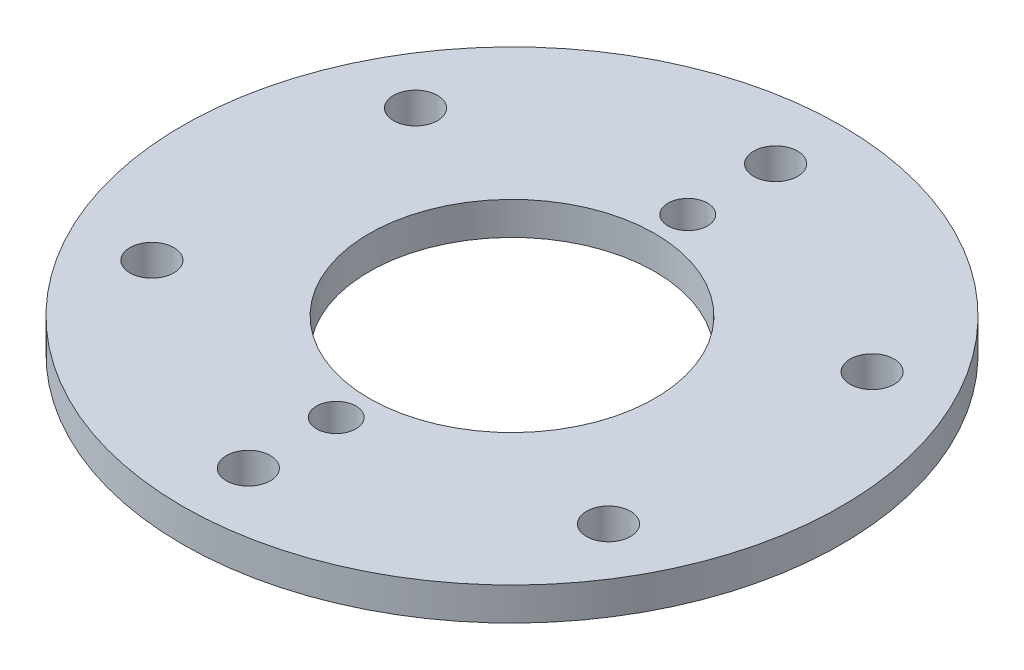
from build123d import *

# Parameters (mm, degrees)
SKETCH1_R             = 150
SKETCH1_R_2           = 65
BOSS_EXTRUDE1_DEPTH   = 15
F_1_0MM_DOWEL_HOLE1_D = 20
CIRPATTERN1_COUNT     = 6
F_1_0MM_DOWEL_HOLE2_D = 18


with BuildPart() as part:
    # Sketch1 → Boss-Extrude1 (new body)
    with BuildSketch(Plane(origin=(0, 0, 0), x_dir=(1, 0, 0), z_dir=(0, 1, 0))):
        with Locations(Location((0, 0, 0), (0, 0, 270))):
            Circle(SKETCH1_R)
        with Locations(Location((0, 0, 0), (0, 0, 270))):
            Circle(SKETCH1_R_2, mode=Mode.SUBTRACT)
    extrude(amount=BOSS_EXTRUDE1_DEPTH)

    # Ø1.0mm Dowel Hole1 (through all)
    with Locations(Plane(origin=(0, 15, 0), x_dir=(1, 0, 0), z_dir=(0, 1, 0))):
        with Locations((0, 120)):
            f_1_0mm_dowel_hole1 = Hole(F_1_0MM_DOWEL_HOLE1_D / 2)

    # CirPattern1: Ø1.0mm Dowel Hole1 ×6 about axis
    cirpattern1_axis = Axis((0, 0, 0), (0, 1, 0))
    for i in range(1, CIRPATTERN1_COUNT):
        add(f_1_0mm_dowel_hole1.rotate(cirpattern1_axis, i * 360 / CIRPATTERN1_COUNT), mode=Mode.SUBTRACT)

    # Ø1.0mm Dowel Hole2 (through all)
    with Locations(Plane(origin=(0, 15, 0), x_dir=(1, 0, 0), z_dir=(0, 1, 0))):
        with Locations((0, 80), (0, -80)):
            Hole(F_1_0MM_DOWEL_HOLE2_D / 2)


solid = part.part
